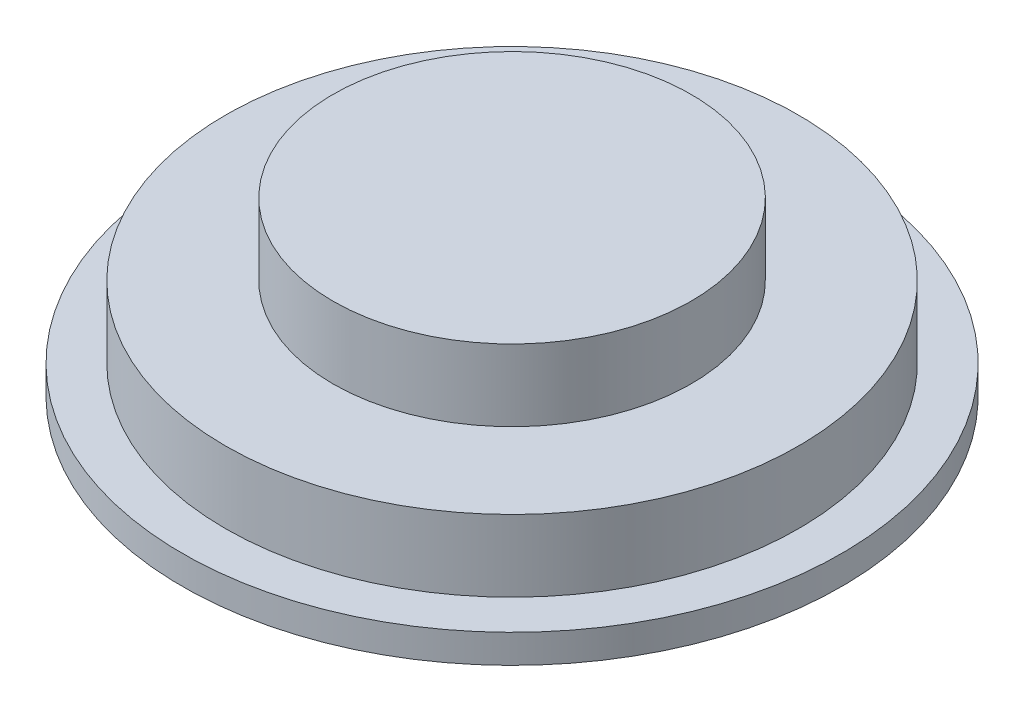
from build123d import *

# Parameters (mm, degrees)
SKETCH_1_R      = 20
EXTRUDE_1_DEPTH = 5
SKETCH_3_R      = 23
EXTRUDE_3_DEPTH = 2
SKETCH_4_R      = 12.5
EXTRUDE_4_DEPTH = 5


with BuildPart() as part:
    # 草图1 → 凸台-拉伸1 (new body)
    with BuildSketch(Plane(origin=(0, 0, 0), x_dir=(1, 0, 0), z_dir=(0, 1, 0))):
        with Locations(Location((0, 0, 0), (0, 0, 270))):
            Circle(SKETCH_1_R)
    extrude(amount=EXTRUDE_1_DEPTH)

    # 草图3 → 凸台-拉伸3 (add)
    with BuildSketch(Plane.XZ):
        with Locations(Location((0, 0, 0), (0, 0, 270))):
            Circle(SKETCH_3_R)
    extrude(amount=EXTRUDE_3_DEPTH)

    # 草图4 → 凸台-拉伸4 (add)
    with BuildSketch(Plane(origin=(0, 5, 0), x_dir=(1, 0, 0), z_dir=(0, 1, 0))):
        with Locations(Location((0, 0, 0), (0, 0, 270))):
            Circle(SKETCH_4_R)
    extrude(amount=EXTRUDE_4_DEPTH)


solid = part.part
